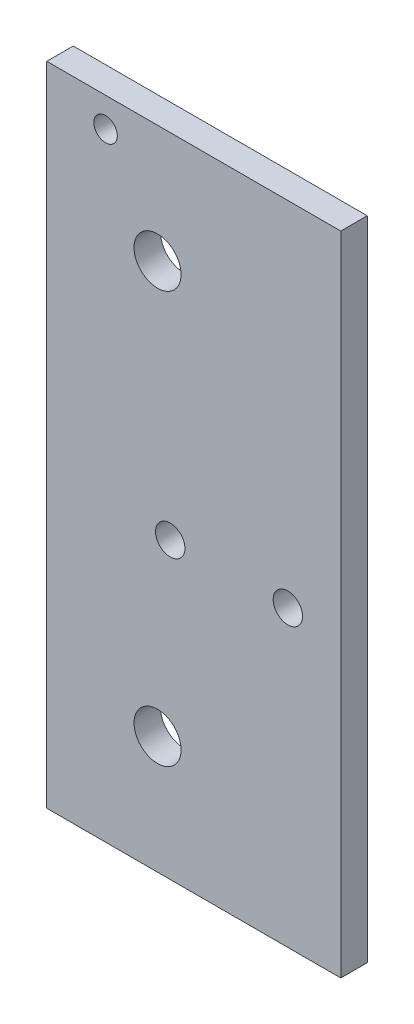
from build123d import *

# Parameters (mm, degrees)
SKETCH1_W           = 50
SKETCH1_H           = 110
BOSS_EXTRUDE1_DEPTH = 4.5
SKETCH2_R           = 4
CUT_EXTRUDE1_DEPTH  = 4.5
SKETCH3_R           = 2.5
CUT_EXTRUDE2_DEPTH  = 4.5
SKETCH6_R           = 2
CUT_EXTRUDE3_DEPTH  = 10


with BuildPart() as part:
    # Sketch1 → Boss-Extrude1 (new body)
    with BuildSketch(Plane.XY):
        with Locations((25, 55)):
            Rectangle(SKETCH1_W, SKETCH1_H)
    extrude(amount=BOSS_EXTRUDE1_DEPTH)

    # Sketch2 → Cut-Extrude1 (cut)
    with BuildSketch(Plane.XY.offset(4.5)):
        with Locations((18.84, 90)):
            Circle(SKETCH2_R)
        with Locations((18.84, 20)):
            Circle(SKETCH2_R)
    extrude(amount=-CUT_EXTRUDE1_DEPTH, mode=Mode.SUBTRACT)

    # Sketch3 → Cut-Extrude2 (cut)
    with BuildSketch(Plane.XY.offset(4.5)):
        with Locations((41, 50)):
            Circle(SKETCH3_R)
        with Locations((21, 50)):
            Circle(SKETCH3_R)
    extrude(amount=-CUT_EXTRUDE2_DEPTH, mode=Mode.SUBTRACT)

    # Sketch6 → Cut-Extrude3 (cut)
    with BuildSketch(Plane.XY.offset(4.5)):
        with Locations((10, 105)):
            Circle(SKETCH6_R)
    extrude(amount=-CUT_EXTRUDE3_DEPTH, mode=Mode.SUBTRACT)


solid = part.part
